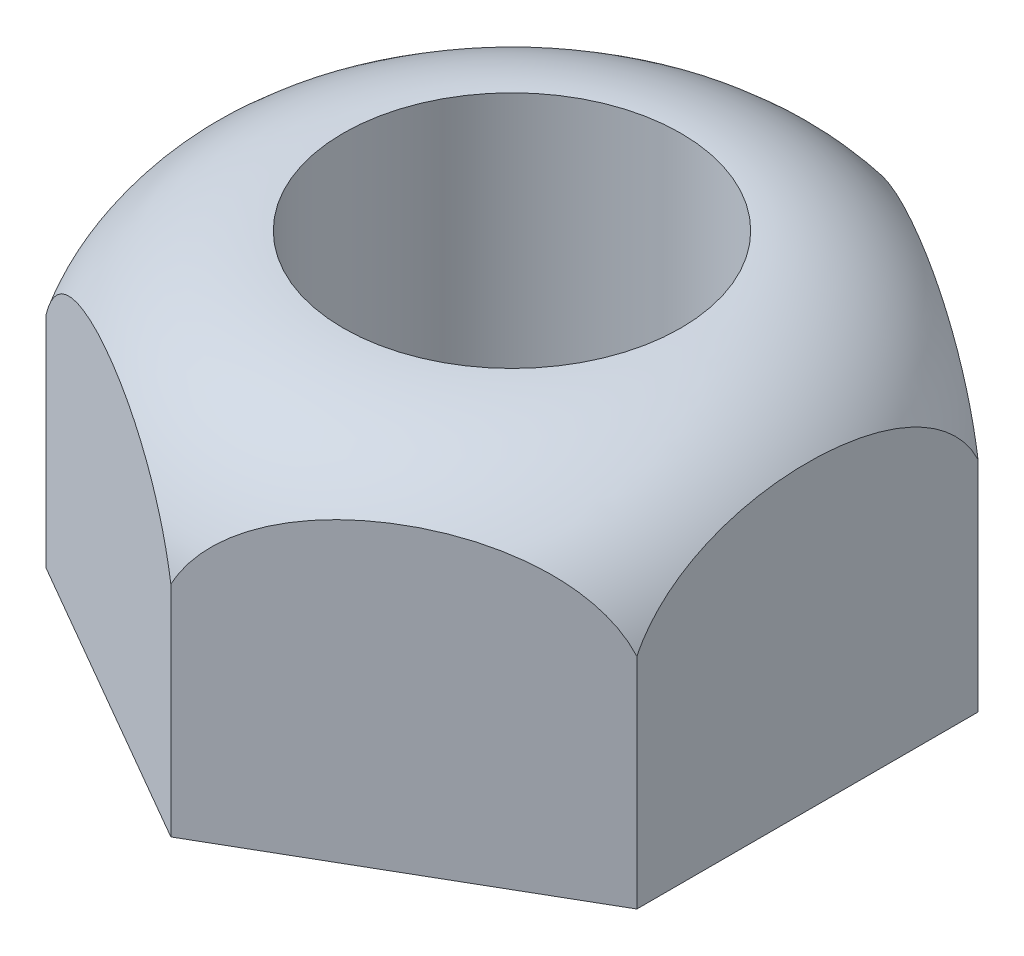
from build123d import *

# Parameters (mm, degrees)
SKETCH3_R           = 2
BOSS_EXTRUDE1_DEPTH = 2.1


with BuildPart() as part:
    # Sketch3 → Boss-Extrude1 (new, symmetric)
    with BuildSketch(Plane(origin=(0, 0, 0), x_dir=(1, 0, 0), z_dir=(0, 1, 0))):
        Polygon((3.5, 2.020725942), (0, 4.041451884), (-3.5, 2.020725942), (-3.5, -2.020725942), (0, -4.041451884), (3.5, -2.020725942), align=None)
        Circle(SKETCH3_R, mode=Mode.SUBTRACT)
    extrude(amount=BOSS_EXTRUDE1_DEPTH, both=True)

    # Sketch5 → Cut-Revolve1 (revolve, cut)
    with BuildSketch(Plane(origin=(0, 0, 0), x_dir=(0, 0, -1), z_dir=(1, 0, 0))):
        with BuildLine():
            Line((2, 2.1), (4.041451884, 2.1))
            Line((4.041451884, 2.1), (4.041451884, 0.492416697))
            ThreePointArc((4.041451884, 0.492416697), (3.299216097, 1.649859852), (2, 2.1))
        make_face()
    revolve(axis=Axis((0, 0, 0), (0, 1, 0)), mode=Mode.SUBTRACT)


solid = part.part
